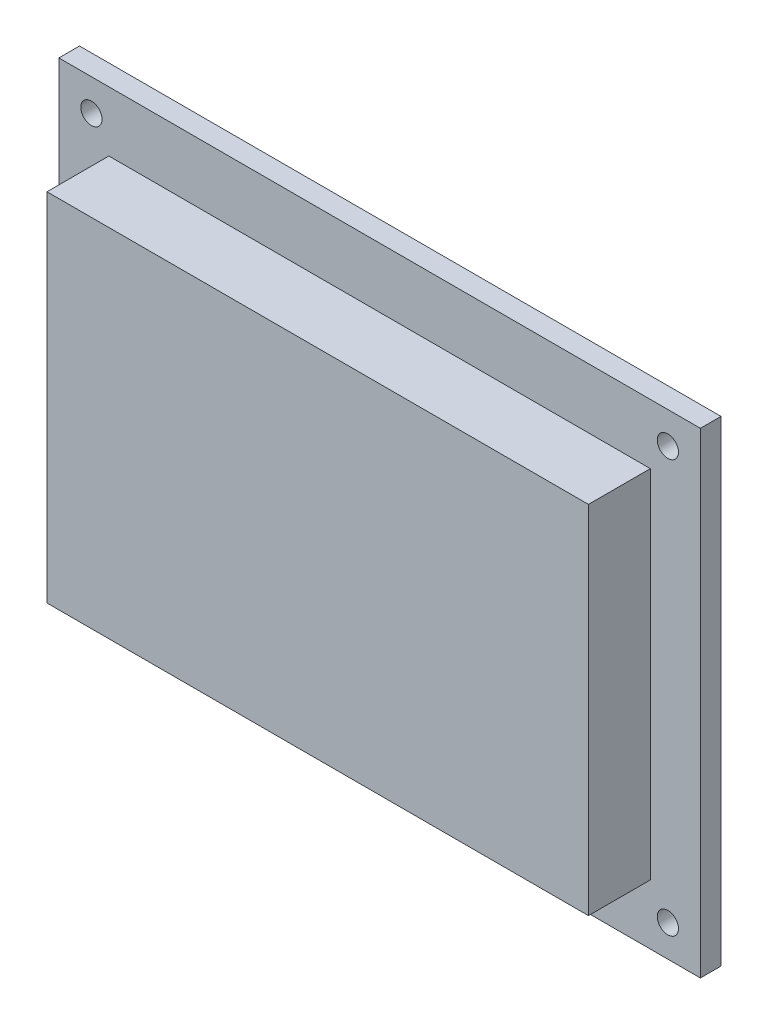
from build123d import *

# Parameters (mm, degrees)
SKETCH1_W             = 98.679
SKETCH1_H             = 73.2282
BOSS_EXTRUDE1_DEPTH   = 3.175
SKETCH2_W             = 83.2866
SKETCH2_H             = 54.7878
BOSS_EXTRUDE2_DEPTH   = 9.525
F_4_CLEARANCE_HOLE1_D = 3.2639


with BuildPart() as part:
    # Sketch1 → Boss-Extrude1 (new body)
    with BuildSketch(Plane.XY):
        Rectangle(SKETCH1_W, SKETCH1_H)
    extrude(amount=BOSS_EXTRUDE1_DEPTH)

    # Sketch2 → Boss-Extrude2 (add)
    with BuildSketch(Plane.XY.offset(3.175)):
        Rectangle(SKETCH2_W, SKETCH2_H)
    extrude(amount=BOSS_EXTRUDE2_DEPTH)

    # #4 Clearance Hole1 (through all)
    with Locations(Plane(origin=(-44.3357, 31.7373, 12.7), x_dir=(1, 0, 0), z_dir=(0, 0, 1))):
        with Locations((0, 0), (88.6714, 0), (88.6714, -63.4746), (0, -63.4746)):
            Hole(F_4_CLEARANCE_HOLE1_D / 2)


solid = part.part
